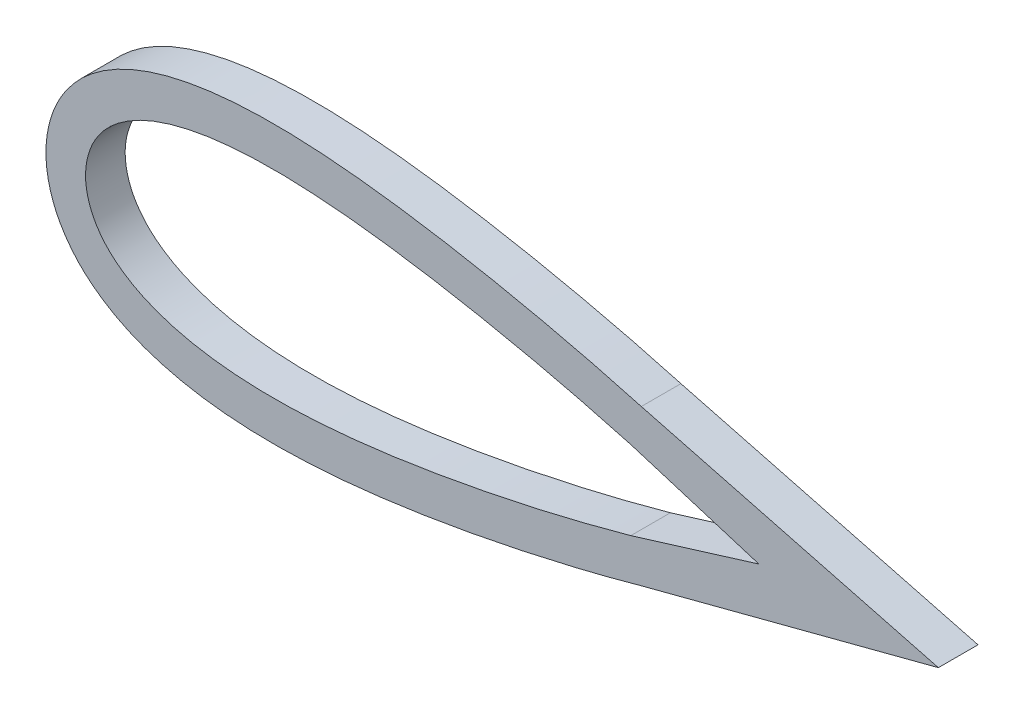
from build123d import *

# Parameters (mm, degrees)
BOSS_EXTRUDE1_DEPTH = 2


with BuildPart() as part:
    # Sketch2 → Boss-Extrude1 (new body)
    with BuildSketch(Plane.XY):
        with BuildLine():
            Line((26.061610232, 3.919750754), (41.061610232, 0))
            Line((41.061610232, 0), (26.061610232, -3.919750754))
            add(Edge.make_bspline(
                [(26.061610232, 3.919750754), (25.790855099, 3.994282748), (25.257212601, 4.141365075), (24.124746985, 4.443231302), (22.178807465, 4.927763239), (19.379102394, 5.554407206), (15.988383722, 6.19552196), (13.104746687, 6.622650275), (10.731498483, 6.867583414), (8.907768934, 6.986114424), (7.036022396, 7.0177739), (5.081459394, 6.92637842), (3.379319289, 6.701469181), (1.922607975, 6.362684216), (0.787164302, 5.998823418), (-0.443995264, 5.459380539), (-1.582452807, 4.728230635), (-2.530228905, 3.845563289), (-3.307344433, 2.791630417), (-3.747821831, 1.753873142), (-3.959063425, 0.798404691), (-4.020468288, 0), (-3.959063425, -0.798404691), (-3.747821831, -1.753873142), (-3.307344433, -2.791630417), (-2.530228905, -3.845563289), (-1.582452807, -4.728230635), (-0.443995264, -5.459380539), (0.787164302, -5.998823418), (1.922607975, -6.362684216), (3.379319289, -6.701469181), (5.081459394, -6.92637842), (7.036022396, -7.0177739), (8.907768934, -6.986114424), (10.731498483, -6.867583414), (13.104746687, -6.622650275), (15.988383722, -6.19552196), (19.379102394, -5.554407206), (22.178807465, -4.927763239), (24.124746985, -4.443231302), (25.257212601, -4.141365075), (25.790855099, -3.994282748), (26.061610232, -3.919750754)],
                knots=[0, 0, 0, 0, 0.015625, 0.03125, 0.0625, 0.125, 0.1875, 0.25, 0.28125, 0.3125, 0.34375, 0.375, 0.40625, 0.421875, 0.4375, 0.453125, 0.46875, 0.4765625, 0.484375, 0.4921875, 0.49609375, 0.5, 0.50390625, 0.5078125, 0.515625, 0.5234375, 0.53125, 0.546875, 0.5625, 0.578125, 0.59375, 0.625, 0.65625, 0.6875, 0.71875, 0.75, 0.8125, 0.875, 0.9375, 0.96875, 0.984375, 1, 1, 1, 1], degree=3))
        make_face()
        with BuildLine():
            Line((25.530805116, 1.991475377), (32, 0))
            Line((32, 0), (25.530805116, -1.991475377))
            add(Edge.make_bspline(
                [(25.530805116, 1.991475377), (24.446339216, 2.290001228), (22.270307795, 2.861173024), (18.974269759, 3.594503765), (15.65255697, 4.223687973), (12.845740412, 4.638755972), (10.56132169, 4.874351685), (8.823153505, 4.987186858), (7.059430534, 5.016530262), (5.254888983, 4.931667568), (3.719302644, 4.727127469), (2.452866595, 4.43200097), (1.4906533, 4.122865609), (0.496556606, 3.684935381), (-0.364078905, 3.128655831), (-1.037880033, 2.497575254), (-1.549458298, 1.799079382), (-1.896878121, 0.988542337), (-2.051560939, 0), (-1.896878121, -0.988542337), (-1.549458298, -1.799079382), (-1.037880033, -2.497575254), (-0.364078905, -3.128655831), (0.496556606, -3.684935381), (1.4906533, -4.122865609), (2.452866595, -4.43200097), (3.719302644, -4.727127469), (5.254888983, -4.931667568), (7.059430534, -5.016530262), (8.823153505, -4.987186858), (10.56132169, -4.874351685), (12.845740412, -4.638755972), (15.65255697, -4.223687973), (18.974269759, -3.594503765), (22.270307795, -2.861173024), (24.446339216, -2.290001228), (25.530805116, -1.991475377)],
                knots=[0, 0, 0, 0, 0.0625, 0.125, 0.1875, 0.25, 0.28125, 0.3125, 0.34375, 0.375, 0.40625, 0.421875, 0.4375, 0.453125, 0.46875, 0.4765625, 0.484375, 0.4921875, 0.5, 0.5078125, 0.515625, 0.5234375, 0.53125, 0.546875, 0.5625, 0.578125, 0.59375, 0.625, 0.65625, 0.6875, 0.71875, 0.75, 0.8125, 0.875, 0.9375, 1, 1, 1, 1], degree=3))
        make_face(mode=Mode.SUBTRACT)
    extrude(amount=BOSS_EXTRUDE1_DEPTH)


solid = part.part
